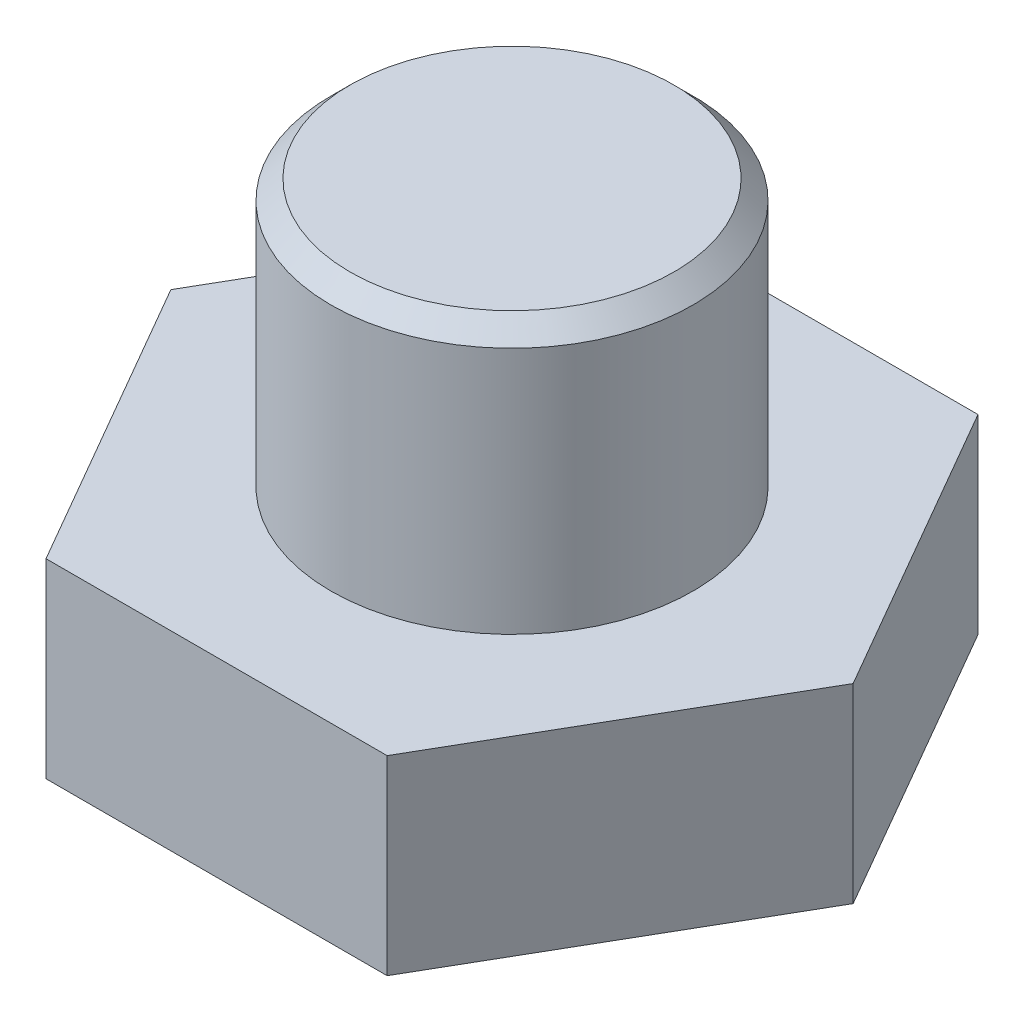
from build123d import *

# Parameters (mm, degrees)
BOSS_EXTRUDE1_DEPTH = 10
SKETCH2_R           = 9.5
BOSS_EXTRUDE2_DEPTH = 14
CHAMFER1_SIZE       = 1


with BuildPart() as part:
    # Sketch1 → Boss-Extrude1 (new body)
    with BuildSketch(Plane(origin=(0, 0, 0), x_dir=(1, 0, 0), z_dir=(0, 1, 0))):
        Polygon((-17.897858345, 0), (-8.948929172, -15.5), (8.948929172, -15.5), (17.897858345, 0), (8.948929172, 15.5), (-8.948929172, 15.5), align=None)
    extrude(amount=-BOSS_EXTRUDE1_DEPTH)

    # Sketch2 → Boss-Extrude2 (add)
    with BuildSketch(Plane(origin=(0, 0, 0), x_dir=(1, 0, 0), z_dir=(0, 1, 0))):
        with Locations(Location((0, 0, 0), (0, 0, 270))):
            Circle(SKETCH2_R)
    extrude(amount=BOSS_EXTRUDE2_DEPTH)

    # Chamfer1
    chamfer1_edges = [part.edges().sort_by_distance(p)[0] for p in [
        (0, 14, -9.5),
    ]]
    chamfer(chamfer1_edges, length=CHAMFER1_SIZE)


solid = part.part
